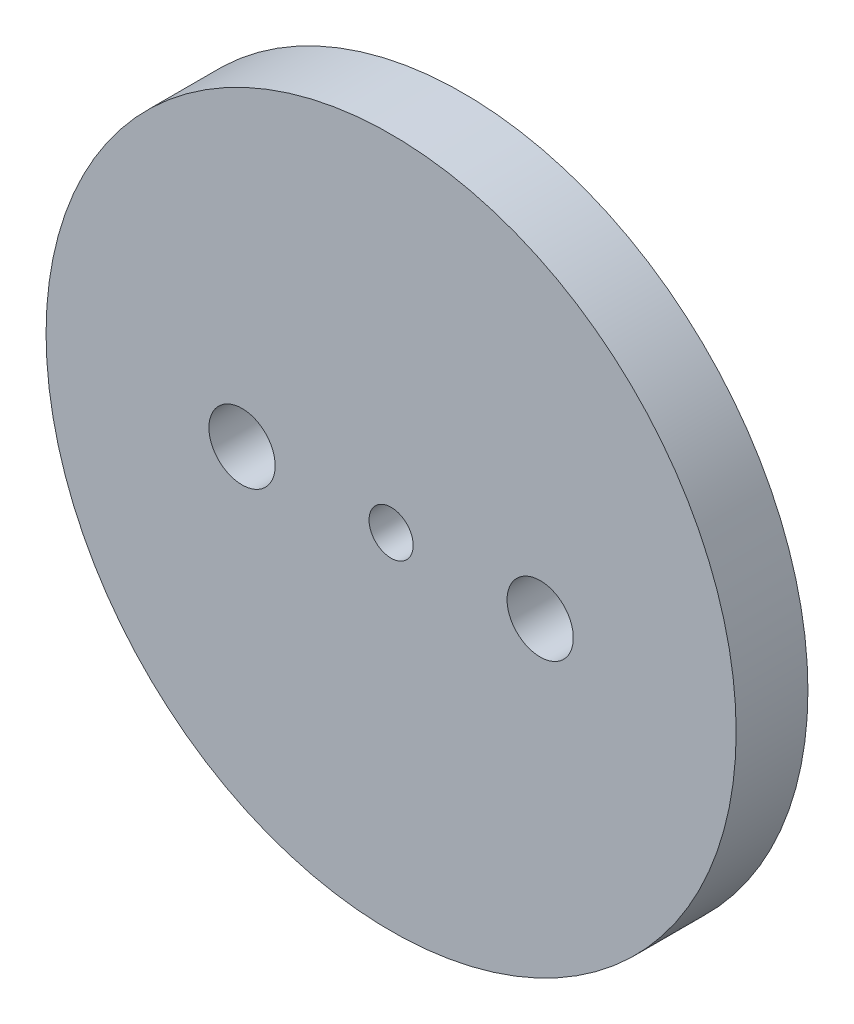
from build123d import *

# Parameters (mm, degrees)
SKETCH1_R           = 62.5
SKETCH1_R_2         = 6
BOSS_EXTRUDE1_DEPTH = 13
SKETCH2_R           = 4
CUT_EXTRUDE1_DEPTH  = 13


with BuildPart() as part:
    # Sketch1 → Boss-Extrude1 (new body)
    with BuildSketch(Plane.XY):
        with Locations(Location((0, 0, 0), (0, 0, 180))):
            Circle(SKETCH1_R)
        with Locations(Location((27, 0, 0), (0, 0, 180))):
            Circle(SKETCH1_R_2, mode=Mode.SUBTRACT)
        with Locations(Location((-27, 0, 0), (0, 0, 180))):
            Circle(SKETCH1_R_2, mode=Mode.SUBTRACT)
    extrude(amount=BOSS_EXTRUDE1_DEPTH)

    # Sketch2 → Cut-Extrude1 (cut)
    with BuildSketch(Plane.XY.offset(13)):
        Circle(SKETCH2_R)
    extrude(amount=-CUT_EXTRUDE1_DEPTH, mode=Mode.SUBTRACT)


solid = part.part
